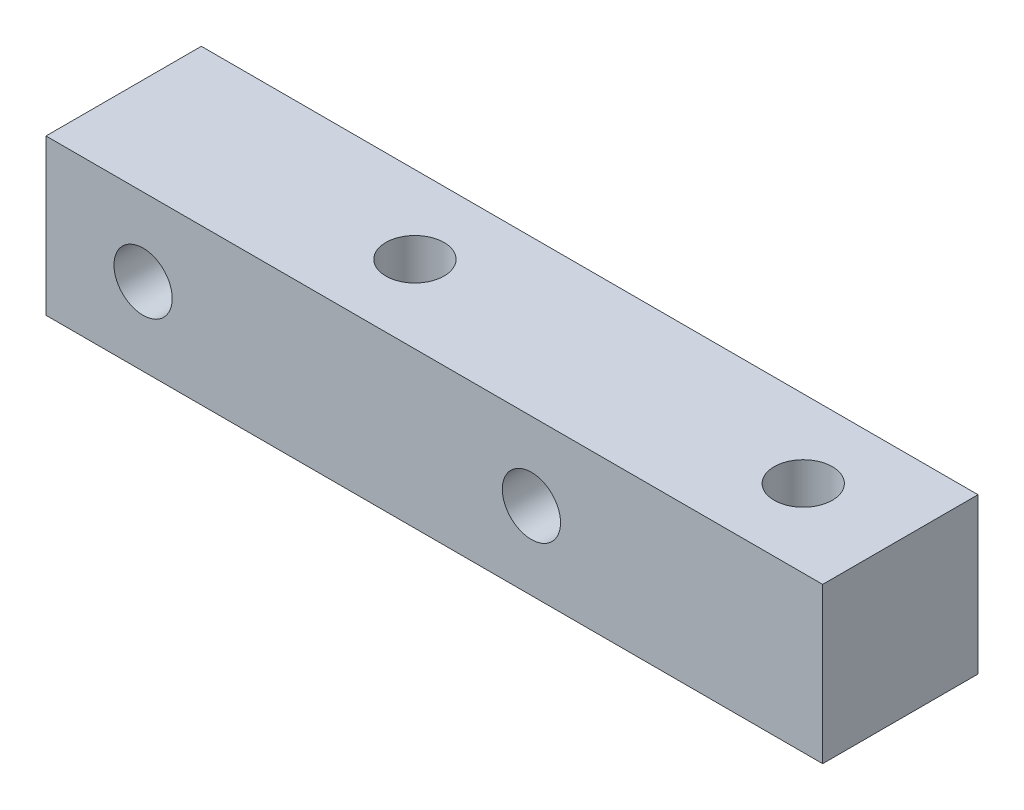
from build123d import *

# Parameters (mm, degrees)
SKETCH_1_W          = 40
SKETCH_1_H          = 8
EXTRUDE_1_DEPTH     = 8
SKETCH_2_R          = 1.5
CUT_EXTRUDE_1_DEPTH = 8
SKETCH_3_R          = 1.5
CUT_EXTRUDE_2_DEPTH = 8


with BuildPart() as part:
    # 草图1 → 凸台-拉伸1 (new body)
    with BuildSketch(Plane(origin=(0, 0, 0), x_dir=(1, 0, 0), z_dir=(0, 1, 0))):
        Rectangle(SKETCH_1_W, SKETCH_1_H)
    extrude(amount=EXTRUDE_1_DEPTH)

    # 草图2 → 切除-拉伸1 (cut)
    with BuildSketch(Plane.XY.offset(4)):
        with Locations((-15, 4)):
            Circle(SKETCH_2_R)
        with Locations((5, 4)):
            Circle(SKETCH_2_R)
    extrude(amount=-CUT_EXTRUDE_1_DEPTH, mode=Mode.SUBTRACT)

    # 草图3 → 切除-拉伸2 (cut)
    with BuildSketch(Plane(origin=(0, 8, 0), x_dir=(1, 0, 0), z_dir=(0, 1, 0))):
        with Locations(Location((-5, 0, 0), (0, 0, 270))):
            Circle(SKETCH_3_R)
        with Locations(Location((15, 0, 0), (0, 0, 270))):
            Circle(SKETCH_3_R)
    extrude(amount=-CUT_EXTRUDE_2_DEPTH, mode=Mode.SUBTRACT)


solid = part.part
